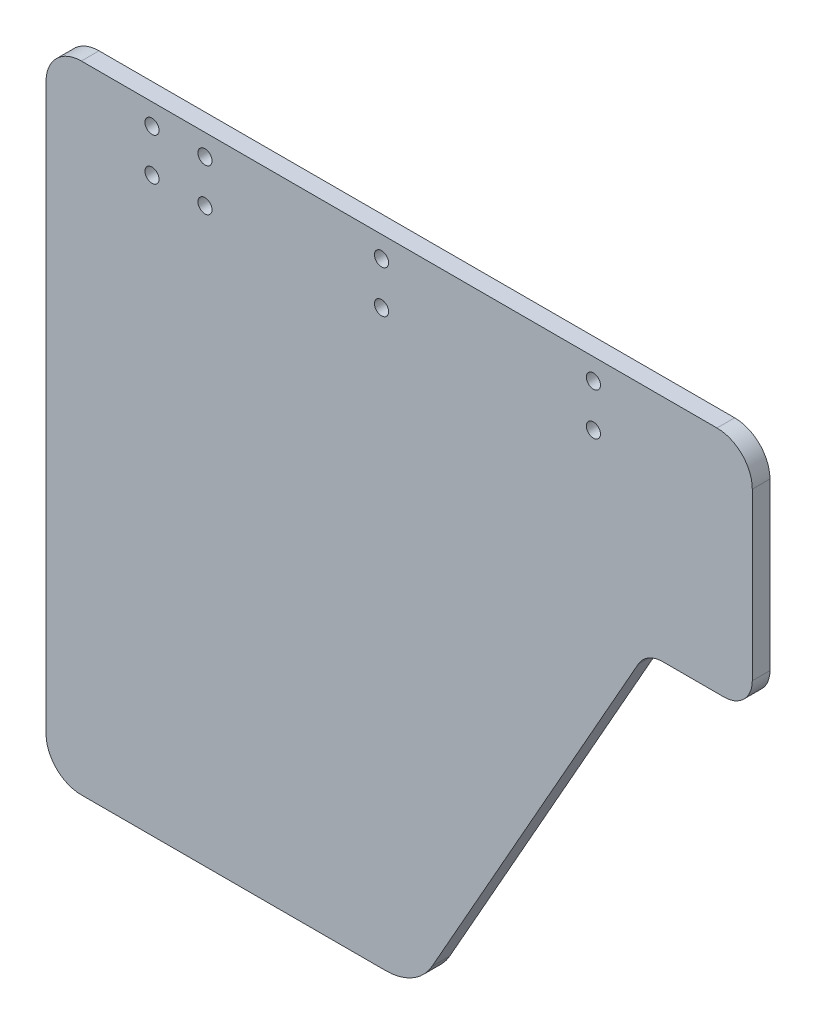
from build123d import *

# Parameters (mm, degrees)
SKETCH_1_W          = 200
SKETCH_1_H          = 180
EXTRUDE_1_DEPTH     = 5
SKETCH_2_R          = 2
CUT_EXTRUDE_1_DEPTH = 135.629120178
FILLET_1_R          = 10
SKETCH_3_W          = 30
SKETCH_3_H          = 115
CUT_EXTRUDE_2_DEPTH = 135.629120178
CUT_EXTRUDE_3_DEPTH = 135.629120178
FILLET_2_R          = 8
FILLET_3_R          = 15


with BuildPart() as part:
    # 草图1 → 凸台-拉伸1 (new body)
    with BuildSketch(Plane.XY):
        Rectangle(SKETCH_1_W, SKETCH_1_H)
    extrude(amount=EXTRUDE_1_DEPTH)

    # 草图2 → 切除-拉伸1 (cut, through all)
    with BuildSketch(Plane.XY.offset(5)):
        with Locations((-70, 84)):
            Circle(SKETCH_2_R)
        with Locations((-70, 72)):
            Circle(SKETCH_2_R)
        with Locations((-55, 84)):
            Circle(SKETCH_2_R)
        with Locations((-55, 72)):
            Circle(SKETCH_2_R)
        with Locations((-5, 84)):
            Circle(SKETCH_2_R)
        with Locations((-5, 72)):
            Circle(SKETCH_2_R)
        with Locations((55, 84)):
            Circle(SKETCH_2_R)
        with Locations((55, 72)):
            Circle(SKETCH_2_R)
    extrude(amount=-CUT_EXTRUDE_1_DEPTH, mode=Mode.SUBTRACT)

    # 圆角1
    fillet_1_edges = [part.edges().sort_by_distance(p)[0] for p in [
        (100, -90, 2.5),
        (-100, -90, 2.5),
        (-100, 90, 2.5),
        (100, 90, 2.5),
    ]]
    fillet(fillet_1_edges, radius=FILLET_1_R)

    # 草图3 → 切除-拉伸2 (cut, through all)
    with BuildSketch(Plane.XY.offset(5)):
        with Locations((85, -32.5)):
            Rectangle(SKETCH_3_W, SKETCH_3_H)
    extrude(amount=-CUT_EXTRUDE_2_DEPTH, mode=Mode.SUBTRACT)

    # 草图4 → 切除-拉伸3 (cut, through all)
    with BuildSketch(Plane.XY.offset(5)):
        Polygon((70, 25), (5, -90), (70, -90), align=None)
    extrude(amount=-CUT_EXTRUDE_3_DEPTH, mode=Mode.SUBTRACT)

    # 圆角2
    fillet_2_edges = [part.edges().sort_by_distance(p)[0] for p in [
        (70, 25, 2.5),
        (100, 25, 2.5),
    ]]
    fillet(fillet_2_edges, radius=FILLET_2_R)

    # 圆角3
    fillet_3_edges = [part.edges().sort_by_distance(p)[0] for p in [
        (5, -90, 2.5),
    ]]
    fillet(fillet_3_edges, radius=FILLET_3_R)


solid = part.part
